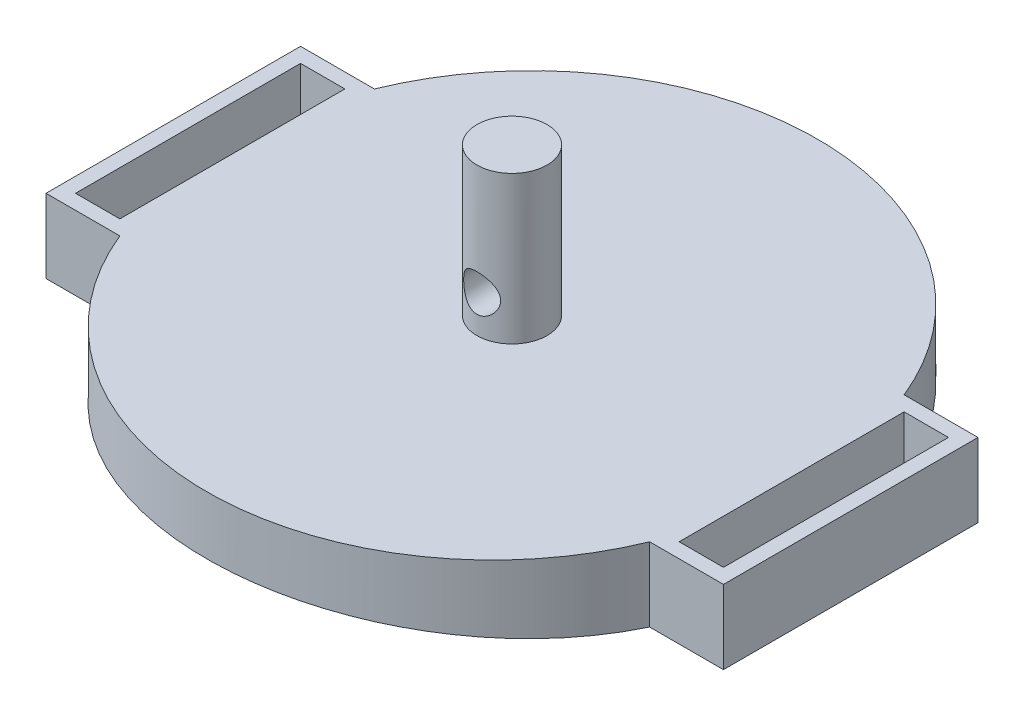
from build123d import *

# Parameters (mm, degrees)
SKETCH4_W           = 6
SKETCH4_H           = 30.460968249
BOSS_EXTRUDE3_DEPTH = 10
SKETCH5_R           = 4.75
BOSS_EXTRUDE4_DEPTH = 20
CUT_EXTRUDE1_REACH  = 73.611
SKETCH6_R           = 2.5
CUT_EXTRUDE2_REACH  = 101.208


with BuildPart() as part:
    # Sketch4 → Boss-Extrude3 (new body)
    with BuildSketch(Plane(origin=(0, 0, 0), x_dir=(1, 0, 0), z_dir=(0, 1, 0))):
        with BuildLine():
            Line((35.857927804, -48.738130517), (45.857927804, -48.738130517))
            Line((45.857927804, -48.738130517), (45.857927804, -14.277162268))
            Line((45.857927804, -14.277162268), (35.857927804, -14.277162268))
            ThreePointArc((35.857927804, -14.277162268), (0, 9.842170723), (-35.857927804, -14.277162268))
            Line((-35.857927804, -14.277162268), (-45.857927804, -14.277162268))
            Line((-45.857927804, -14.277162268), (-45.857927804, -48.738130517))
            Line((-45.857927804, -48.738130517), (-35.857927804, -48.738130517))
            ThreePointArc((-35.857927804, -48.738130517), (0, -72.857463508), (35.857927804, -48.738130517))
        make_face()
        with Locations((40.857927804, -31.507646392)):
            Rectangle(SKETCH4_W, SKETCH4_H, mode=Mode.SUBTRACT)
        with Locations((-40.857927804, -31.507646392)):
            Rectangle(SKETCH4_W, SKETCH4_H, mode=Mode.SUBTRACT)
    extrude(amount=BOSS_EXTRUDE3_DEPTH)

    # Sketch5 → Boss-Extrude4 (add)
    with BuildSketch(Plane(origin=(0, 10, 0), x_dir=(1, 0, 0), z_dir=(0, 1, 0))):
        with Locations(Location((0, -31.507646393, 0), (0, 0, 90))):
            Circle(SKETCH5_R)
    extrude(amount=BOSS_EXTRUDE4_DEPTH)

    # Sketch6 → Cut-Extrude1 (cut, up to next)
    with BuildSketch(Plane(origin=(0, 0, 26.757646393), x_dir=(-1, 0, 0), z_dir=(0, 0, -1)), mode=Mode.PRIVATE) as cut_extrude1_sk1:
        with Locations((0, 15)):
            Circle(SKETCH6_R)
    cut_extrude1_tool1 = extrude(cut_extrude1_sk1.sketch, amount=-CUT_EXTRUDE1_REACH, mode=Mode.PRIVATE) & part.part
    add(cut_extrude1_tool1.solids().sort_by_distance((0, 15, 26.757646))[0], mode=Mode.SUBTRACT)

    # Sketch7 → Cut-Extrude2 (cut, up to next)
    with BuildSketch(Plane.XY.offset(72.857463508), mode=Mode.PRIVATE) as cut_extrude2_sk1:
        with BuildLine():
            Line((-35.857927804, 0), (35.857927804, 0))
            ThreePointArc((35.857927804, 0), (0, 2.127613267), (-35.857927804, 0))
        make_face()
    cut_extrude2_tool1 = extrude(cut_extrude2_sk1.sketch, amount=-CUT_EXTRUDE2_REACH, mode=Mode.PRIVATE) & part.part
    add(cut_extrude2_tool1.solids().sort_by_distance((0, 0.851302, 72.857464))[0], mode=Mode.SUBTRACT)


solid = part.part
